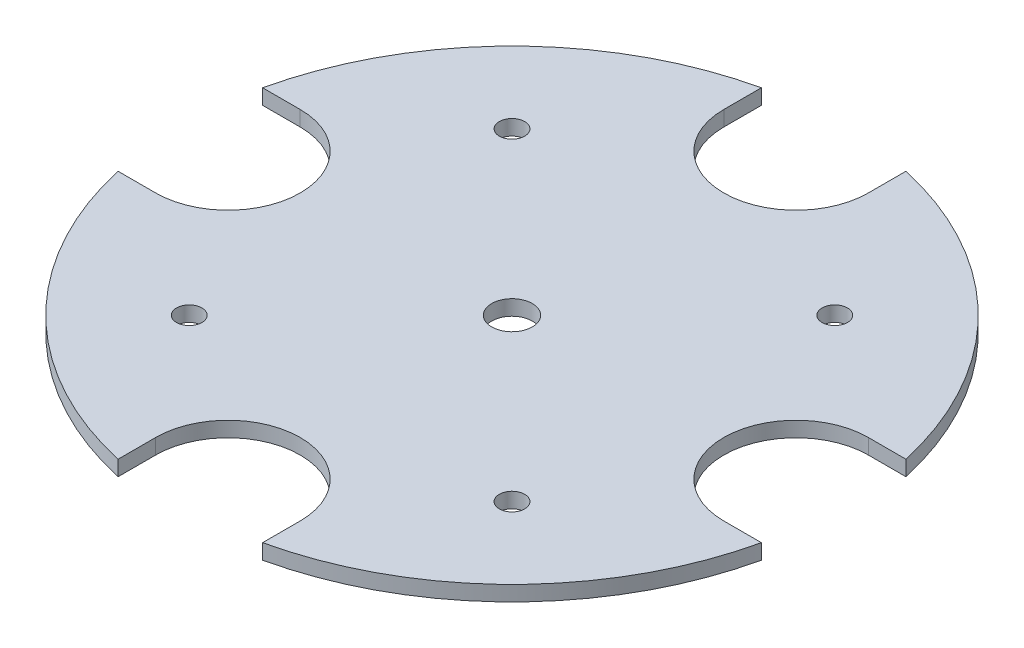
from build123d import *

# Parameters (mm, degrees)
SKETCH1_R           = 2.5
SKETCH1_R_2         = 4
BOSS_EXTRUDE1_DEPTH = 3


with BuildPart() as part:
    # Sketch1 → Boss-Extrude1 (new body)
    with BuildSketch(Plane(origin=(0, 0, 0), x_dir=(1, 0, 0), z_dir=(0, 1, 0))):
        with BuildLine():
            Line((-56, 14.25), (-63.418747228, 14.25))
            ThreePointArc((-63.418747228, 14.25), (-45.961940777, 45.961940777), (-14.25, 63.418747228))
            Line((-14.25, 63.418747228), (-14.25, 56))
            ThreePointArc((-14.25, 56), (0, 41.75), (14.25, 56))
            Line((14.25, 56), (14.25, 63.418747228))
            ThreePointArc((14.25, 63.418747228), (45.961940777, 45.961940777), (63.418747228, 14.25))
            Line((63.418747228, 14.25), (56, 14.25))
            ThreePointArc((56, 14.25), (41.75, 0), (56, -14.25))
            Line((56, -14.25), (63.418747228, -14.25))
            ThreePointArc((63.418747228, -14.25), (45.961940777, -45.961940777), (14.25, -63.418747228))
            Line((14.25, -63.418747228), (14.25, -56))
            ThreePointArc((14.25, -56), (0, -41.75), (-14.25, -56))
            Line((-14.25, -56), (-14.25, -63.418747228))
            ThreePointArc((-14.25, -63.418747228), (-45.961940777, -45.961940777), (-63.418747228, -14.25))
            Line((-63.418747228, -14.25), (-56, -14.25))
            ThreePointArc((-56, -14.25), (-41.75, 0), (-56, 14.25))
        make_face()
        with Locations(Location((-31.819805153, 31.819805153, 0), (0, 0, 270))):
            Circle(SKETCH1_R, mode=Mode.SUBTRACT)
        with Locations(Location((31.819805153, 31.819805153, 0), (0, 0, 270))):
            Circle(SKETCH1_R, mode=Mode.SUBTRACT)
        with Locations(Location((31.819805153, -31.819805153, 0), (0, 0, 270))):
            Circle(SKETCH1_R, mode=Mode.SUBTRACT)
        with Locations(Location((-31.819805153, -31.819805153, 0), (0, 0, 270))):
            Circle(SKETCH1_R, mode=Mode.SUBTRACT)
        with Locations(Location((0, 0, 0), (0, 0, 270))):
            Circle(SKETCH1_R_2, mode=Mode.SUBTRACT)
    extrude(amount=BOSS_EXTRUDE1_DEPTH)


solid = part.part
